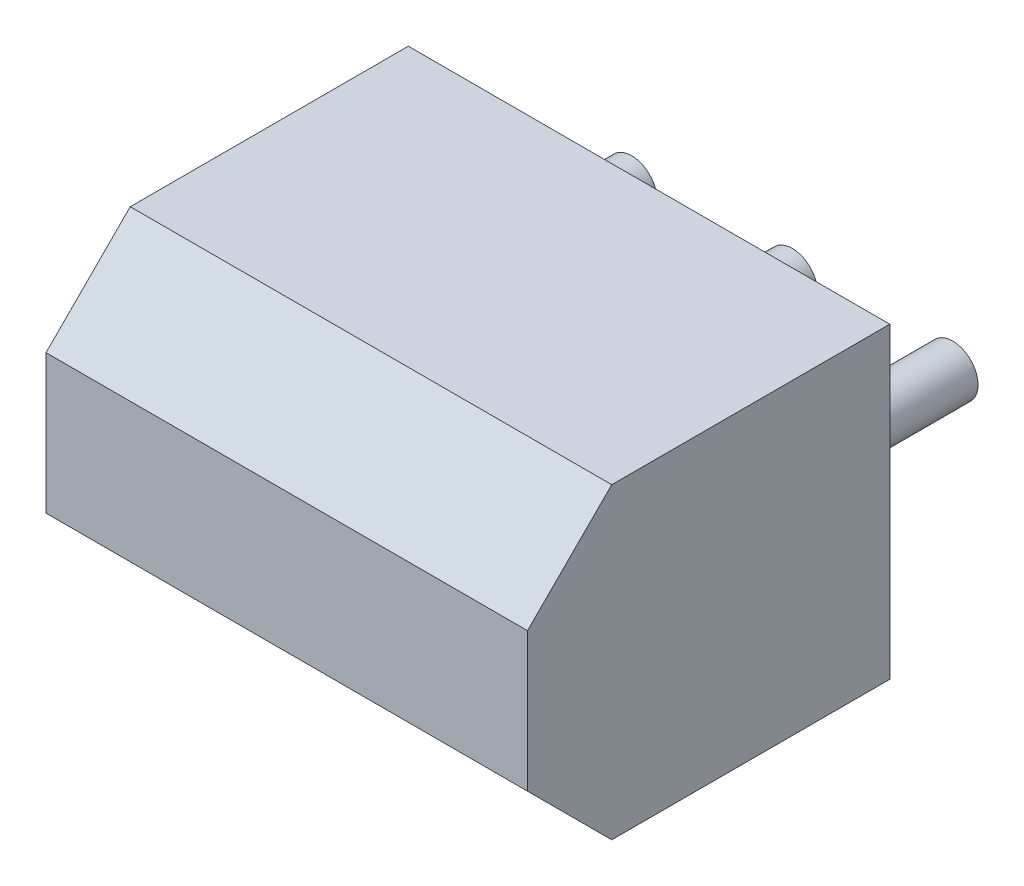
from build123d import *

# Parameters (mm, degrees)
SKETCH_1_W                 = 11.43
SKETCH_1_H                 = 7.3
EXTRUDE_1_DEPTH            = 8.6
CHAMFER_1_SIZE             = 2
SKETCH_2_W                 = 1.5
SKETCH_2_H                 = 2.244760595
CUT_EXTRUDE_1_DEPTH        = 0.5
PATTERN_LINEAR_1_COUNT     = 2
PATTERN_LINEAR_1_PITCH     = 3.81
PATTERN_LINEAR_1_COL_COUNT = 2
PATTERN_LINEAR_1_COL_PITCH = 3.81
SKETCH_3_R                 = 0.6
EXTRUDE_2_DEPTH            = 3.4
PATTERN_LINEAR_2_COUNT     = 2
PATTERN_LINEAR_2_PITCH     = 3.81
PATTERN_LINEAR_2_COL_COUNT = 2
PATTERN_LINEAR_2_COL_PITCH = 3.81
PATTERN_LINEAR_3_COUNT     = 2
PATTERN_LINEAR_3_PITCH     = 3.81


with BuildPart() as part:
    # 草图1 → 凸台-拉伸1 (new body)
    with BuildSketch(Plane.XY):
        with Locations((5.715, 3.65)):
            Rectangle(SKETCH_1_W, SKETCH_1_H)
    extrude(amount=EXTRUDE_1_DEPTH)

    # 倒角1
    chamfer_1_edges = [part.edges().sort_by_distance(p)[0] for p in [
        (5.715, 7.3, 8.6),
        (5.715, 0, 8.6),
    ]]
    chamfer(chamfer_1_edges, length=CHAMFER_1_SIZE)

    # 草图2 → 切除-拉伸1 (cut)
    with BuildSketch(Plane.XZ):
        with Locations((5.715, 3.602057757)):
            Rectangle(SKETCH_2_W, SKETCH_2_H)
    cut_extrude_1 = extrude(amount=-CUT_EXTRUDE_1_DEPTH, mode=Mode.SUBTRACT)

    # 阵列(线性)1: 切除-拉伸1 ×2
    with Locations(*[(i * PATTERN_LINEAR_1_PITCH, 0, 0) for i in range(1, PATTERN_LINEAR_1_COUNT)]):
        add(cut_extrude_1, mode=Mode.SUBTRACT)

    # 阵列(线性)1 col: 切除-拉伸1 ×2
    with Locations(*[(-i * PATTERN_LINEAR_1_COL_PITCH, 0, 0) for i in range(1, PATTERN_LINEAR_1_COL_COUNT)]):
        add(cut_extrude_1, mode=Mode.SUBTRACT)

    # 草图3 → 凸台-拉伸2 (add)
    with BuildSketch(Plane(origin=(0, 0, 0), x_dir=(-1, 0, 0), z_dir=(0, 0, -1))):
        with Locations((-5.715, 3.7)):
            Circle(SKETCH_3_R)
    extrude_2 = extrude(amount=EXTRUDE_2_DEPTH)

    # 阵列(线性)2: 凸台-拉伸2 ×2
    with Locations(*[(-i * PATTERN_LINEAR_2_PITCH, 0, 0) for i in range(1, PATTERN_LINEAR_2_COUNT)]):
        add(extrude_2)

    # 阵列(线性)2 col: 凸台-拉伸2 ×2
    with Locations(*[(i * PATTERN_LINEAR_2_COL_PITCH, 0, 0) for i in range(1, PATTERN_LINEAR_2_COL_COUNT)]):
        add(extrude_2)

    # 阵列(线性)3: 凸台-拉伸2 ×2
    with Locations(*[(-i * PATTERN_LINEAR_3_PITCH, 0, 0) for i in range(1, PATTERN_LINEAR_3_COUNT)]):
        add(extrude_2)


solid = part.part
